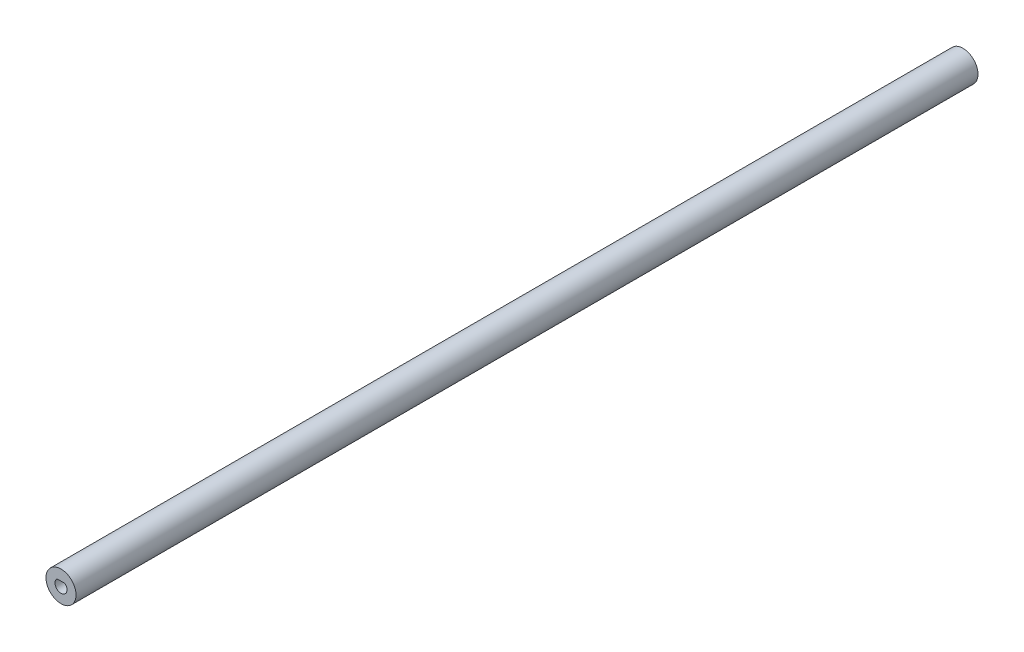
from build123d import *

# Parameters (mm, degrees)
SKETCH1_R           = 5
BOSS_EXTRUDE1_DEPTH = 300
CUT_EXTRUDE2_DEPTH  = 8


with BuildPart() as part:
    # Sketch1 → Boss-Extrude1 (new body)
    with BuildSketch(Plane.XY):
        with Locations((-21.928145629, 1.412024527)):
            Circle(SKETCH1_R)
    extrude(amount=BOSS_EXTRUDE1_DEPTH)

    # Sketch3 → Cut-Extrude2 (cut)
    with BuildSketch(Plane.XY.offset(300)):
        with BuildLine():
            Line((-23.251021285, 2.912024527), (-20.605269974, 2.912024527))
            ThreePointArc((-20.605269974, 2.912024527), (-21.928145629, -0.587975473), (-23.251021285, 2.912024527))
        make_face()
    extrude(amount=-CUT_EXTRUDE2_DEPTH, mode=Mode.SUBTRACT)


solid = part.part
